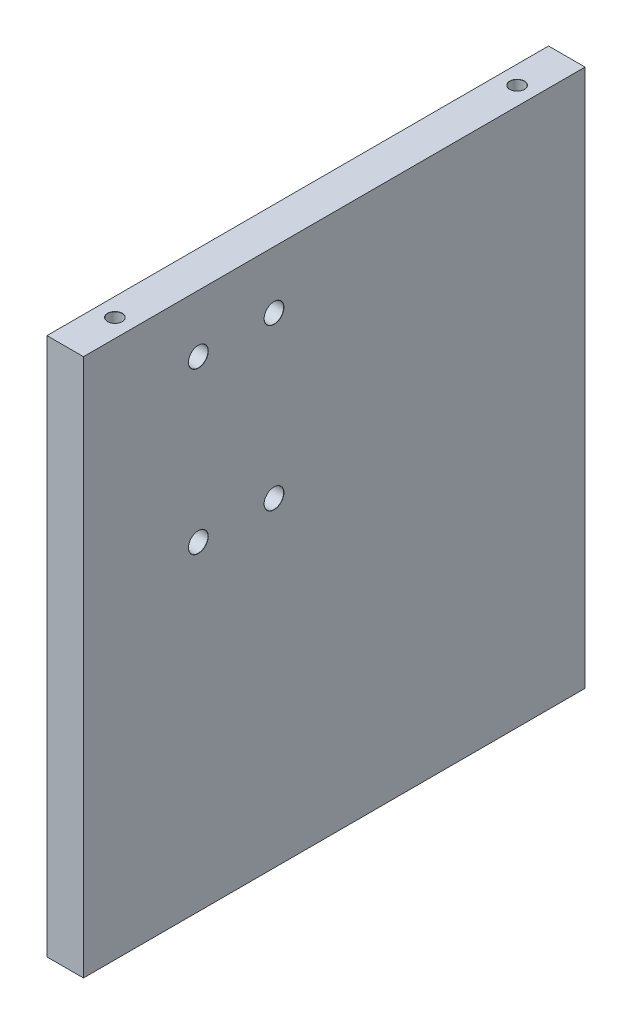
from build123d import *

# Parameters (mm, degrees)
SKETCH1_W                             = 87.3
SKETCH1_H                             = 93.65
BOSS_EXTRUDE1_DEPTH                   = 6.35
TAP_DRILL_FOR_M3X0_5_TAP1_D           = 2.5
TAP_DRILL_FOR_M3X0_5_TAP1_DEPTH       = 10
TAP_DRILL_FOR_M3X0_5_TAP1_CSINK_D     = 2.55
TAP_DRILL_FOR_M3X0_5_TAP1_CSINK_ANGLE = 90
TAP_DRILL_FOR_M3X0_5_TAP1_TIP         = 0.751075774
TAP_DRILL_FOR_M3X0_5_TAP2_D           = 2.5
TAP_DRILL_FOR_M3X0_5_TAP2_DEPTH       = 9.248924226
TAP_DRILL_FOR_M3X0_5_TAP2_CSINK_D     = 2.55
TAP_DRILL_FOR_M3X0_5_TAP2_CSINK_ANGLE = 90
TAP_DRILL_FOR_M3X0_5_TAP2_TIP         = 0.751075774
M3_CLEARANCE_HOLE2_D                  = 3.4
M3_CLEARANCE_HOLE2_CSINK_D            = 3.45
M3_CLEARANCE_HOLE2_CSINK_ANGLE        = 90


with BuildPart() as part:
    # Sketch1 → Boss-Extrude1 (new body)
    with BuildSketch(Plane(origin=(0, 0, 0), x_dir=(0, 0, -1), z_dir=(1, 0, 0))):
        Rectangle(SKETCH1_W, SKETCH1_H)
    extrude(amount=BOSS_EXTRUDE1_DEPTH)

    # Tap Drill for M3x0.5 Tap1
    with Locations(Plane(origin=(0, 46.825, 0), x_dir=(1, 0, 0), z_dir=(0, 1, 0))):
        with Locations((3.175, 35), (3.175, -35)):
            CounterSinkHole(TAP_DRILL_FOR_M3X0_5_TAP1_D / 2, TAP_DRILL_FOR_M3X0_5_TAP1_CSINK_D / 2, depth=TAP_DRILL_FOR_M3X0_5_TAP1_DEPTH, counter_sink_angle=TAP_DRILL_FOR_M3X0_5_TAP1_CSINK_ANGLE)
            with Locations((0, 0, -(TAP_DRILL_FOR_M3X0_5_TAP1_DEPTH + TAP_DRILL_FOR_M3X0_5_TAP1_TIP / 2))):  # 118° drill point
                Cone(0, TAP_DRILL_FOR_M3X0_5_TAP1_D / 2, TAP_DRILL_FOR_M3X0_5_TAP1_TIP, mode=Mode.SUBTRACT)

    # Tap Drill for M3x0.5 Tap2
    with Locations(Plane(origin=(0, -46.825, 0), x_dir=(-1, 0, 0), z_dir=(0, -1, 0))):
        with Locations((-3.175, -35), (-3.175, 35)):
            CounterSinkHole(TAP_DRILL_FOR_M3X0_5_TAP2_D / 2, TAP_DRILL_FOR_M3X0_5_TAP2_CSINK_D / 2, depth=TAP_DRILL_FOR_M3X0_5_TAP2_DEPTH, counter_sink_angle=TAP_DRILL_FOR_M3X0_5_TAP2_CSINK_ANGLE)
            with Locations((0, 0, -(TAP_DRILL_FOR_M3X0_5_TAP2_DEPTH + TAP_DRILL_FOR_M3X0_5_TAP2_TIP / 2))):  # 118° drill point
                Cone(0, TAP_DRILL_FOR_M3X0_5_TAP2_D / 2, TAP_DRILL_FOR_M3X0_5_TAP2_TIP, mode=Mode.SUBTRACT)

    # M3 Clearance Hole2 (through all)
    with Locations(Plane(origin=(6.35, 0, 0), x_dir=(0, 0, -1), z_dir=(1, 0, 0))):
        with Locations((-23.65, 36.825), (-10.48, 36.825), (-10.48, 8.885), (-23.65, 8.885)):
            CounterSinkHole(M3_CLEARANCE_HOLE2_D / 2, M3_CLEARANCE_HOLE2_CSINK_D / 2, counter_sink_angle=M3_CLEARANCE_HOLE2_CSINK_ANGLE)


solid = part.part
